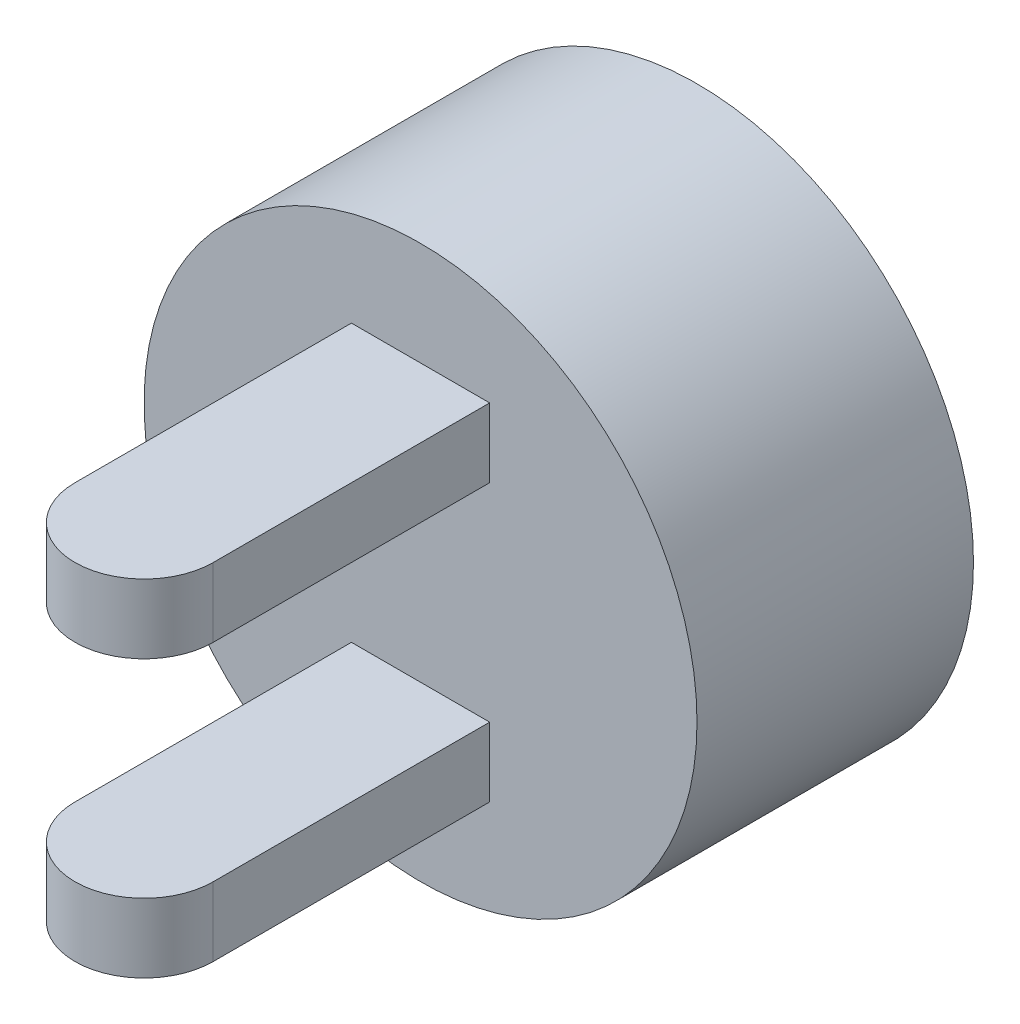
from build123d import *

# Parameters (mm, degrees)
SKETCH1_R           = 200
BOSS_EXTRUDE1_DEPTH = 200
BOSS_EXTRUDE2_START = 75
BOSS_EXTRUDE2_DEPTH = 50
BOSS_EXTRUDE3_START = -125
BOSS_EXTRUDE3_DEPTH = 50


with BuildPart() as part:
    # Sketch1 → Boss-Extrude1 (new body)
    with BuildSketch(Plane.XY):
        Circle(SKETCH1_R)
    extrude(amount=BOSS_EXTRUDE1_DEPTH)

    # Sketch2 → Boss-Extrude2 (add)
    with BuildSketch(Plane(origin=(0, 0, 0), x_dir=(1, 0, 0), z_dir=(0, 1, 0)).offset(BOSS_EXTRUDE2_START)):
        with BuildLine():
            Line((-50, -200), (-50, -400))
            ThreePointArc((-50, -400), (0, -450), (50, -400))
            Line((50, -400), (50, -200))
            Line((50, -200), (-50, -200))
        make_face()
    extrude(amount=BOSS_EXTRUDE2_DEPTH)

    # Sketch2<2> → Boss-Extrude3 (add)
    with BuildSketch(Plane(origin=(0, 0, 0), x_dir=(1, 0, 0), z_dir=(0, 1, 0)).offset(BOSS_EXTRUDE3_START)):
        with BuildLine():
            Line((-50, -200), (-50, -400))
            ThreePointArc((-50, -400), (0, -450), (50, -400))
            Line((50, -400), (50, -200))
            Line((50, -200), (-50, -200))
        make_face()
    extrude(amount=BOSS_EXTRUDE3_DEPTH)


solid = part.part
